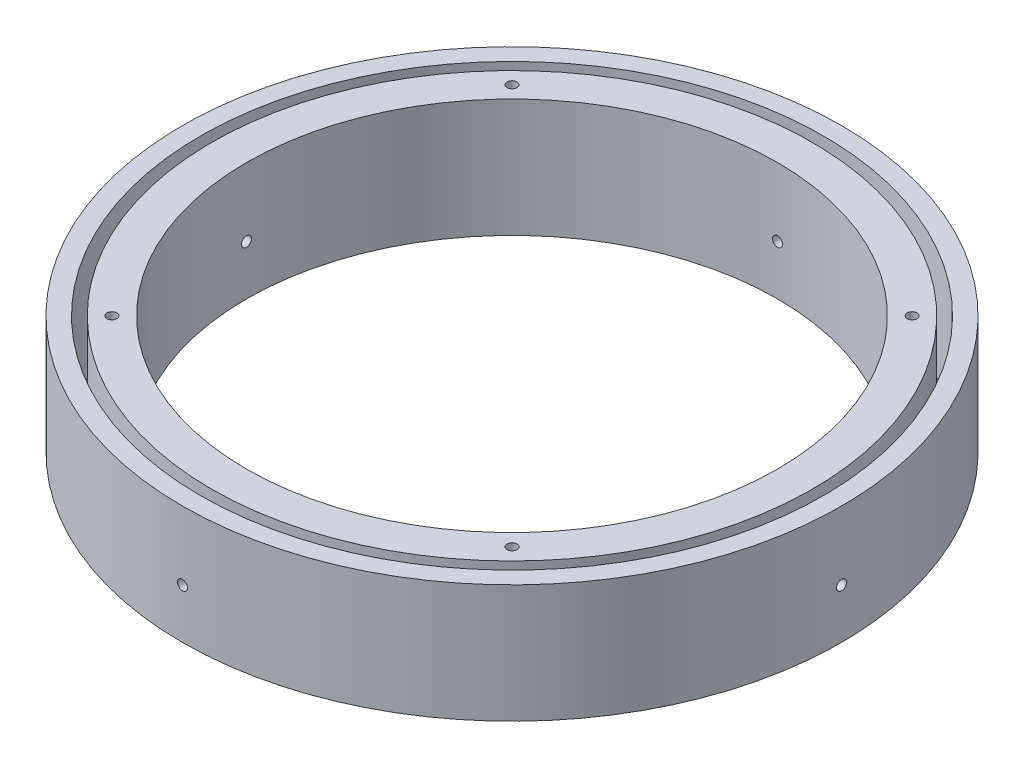
from build123d import *

# Parameters (mm, degrees)
SKETCH1_R           = 106
BOSS_EXTRUDE1_DEPTH = 38
SKETCH2_R           = 100.2
SKETCH2_R_2         = 96.6
CUT_EXTRUDE1_DEPTH  = 36
SKETCH3_R           = 85.4
CUT_EXTRUDE2_DEPTH  = 155.647987378
SKETCH5_R           = 1.6
CUT_EXTRUDE3_DEPTH  = 155.647987378
CUT_EXTRUDE4_START  = -8
SKETCH6_R           = 1.6
CUT_EXTRUDE4_DEPTH  = 231.584815295
CIRPATTERN1_COUNT   = 4
CUT_EXTRUDE5_START  = 3
CUT_EXTRUDE5_DEPTH  = 2.8
CIRPATTERN2_COUNT   = 4


with BuildPart() as part:
    # Sketch1 → Boss-Extrude1 (new body)
    with BuildSketch(Plane(origin=(0, 0, 0), x_dir=(1, 0, 0), z_dir=(0, 1, 0))):
        Circle(SKETCH1_R)
    extrude(amount=BOSS_EXTRUDE1_DEPTH)

    # Sketch2 → Cut-Extrude1 (cut)
    with BuildSketch(Plane(origin=(0, 38, 0), x_dir=(1, 0, 0), z_dir=(0, 1, 0))):
        Circle(SKETCH2_R)
        Circle(SKETCH2_R_2, mode=Mode.SUBTRACT)
    extrude(amount=-CUT_EXTRUDE1_DEPTH, mode=Mode.SUBTRACT)

    # Sketch3 → Cut-Extrude2 (cut, through all)
    with BuildSketch(Plane(origin=(0, 38, 0), x_dir=(1, 0, 0), z_dir=(0, 1, 0))):
        Circle(SKETCH3_R)
    extrude(amount=-CUT_EXTRUDE2_DEPTH, mode=Mode.SUBTRACT)

    # Sketch5 → Cut-Extrude3 (cut, through all)
    with BuildSketch(Plane(origin=(0, 38, 0), x_dir=(1, 0, 0), z_dir=(0, 1, 0))):
        with Locations((-64.346717088, 64.346717088)):
            Circle(SKETCH5_R)
        with Locations((64.346717088, 64.346717088)):
            Circle(SKETCH5_R)
        with Locations((64.346717088, -64.346717088)):
            Circle(SKETCH5_R)
        with Locations((-64.346717088, -64.346717088)):
            Circle(SKETCH5_R)
    extrude(amount=-CUT_EXTRUDE3_DEPTH, mode=Mode.SUBTRACT)

    # Sketch6 → Cut-Extrude4 (cut)
    with BuildSketch(Plane.XY.offset(86).offset(CUT_EXTRUDE4_START)):
        with Locations((0, 16)):
            Circle(SKETCH6_R)
    cut_extrude4 = extrude(amount=CUT_EXTRUDE4_DEPTH, mode=Mode.SUBTRACT)

    # CirPattern1: Cut-Extrude4 ×4 about axis
    cirpattern1_axis = Axis((0, 38, 0), (0, -1, 0))
    for i in range(1, CIRPATTERN1_COUNT):
        add(cut_extrude4.rotate(cirpattern1_axis, i * 360 / CIRPATTERN1_COUNT), mode=Mode.SUBTRACT)

    # Sketch7 → Cut-Extrude5 (cut)
    with BuildSketch(Plane.XY.offset(86).offset(CUT_EXTRUDE5_START)):
        Polygon((-3.05, 17.760918321), (-3.05, 37.760918321), (3.05, 37.760918321), (3.05, 17.760918321), (3.05, 14.239081679), (0, 12.478163358), (-3.05, 14.239081679), align=None)
    cut_extrude5 = extrude(amount=CUT_EXTRUDE5_DEPTH, mode=Mode.SUBTRACT)

    # CirPattern2: Cut-Extrude5 ×4 about axis
    cirpattern2_axis = Axis((0, 38, 0), (0, -1, 0))
    for i in range(1, CIRPATTERN2_COUNT):
        add(cut_extrude5.rotate(cirpattern2_axis, i * 360 / CIRPATTERN2_COUNT), mode=Mode.SUBTRACT)


solid = part.part
